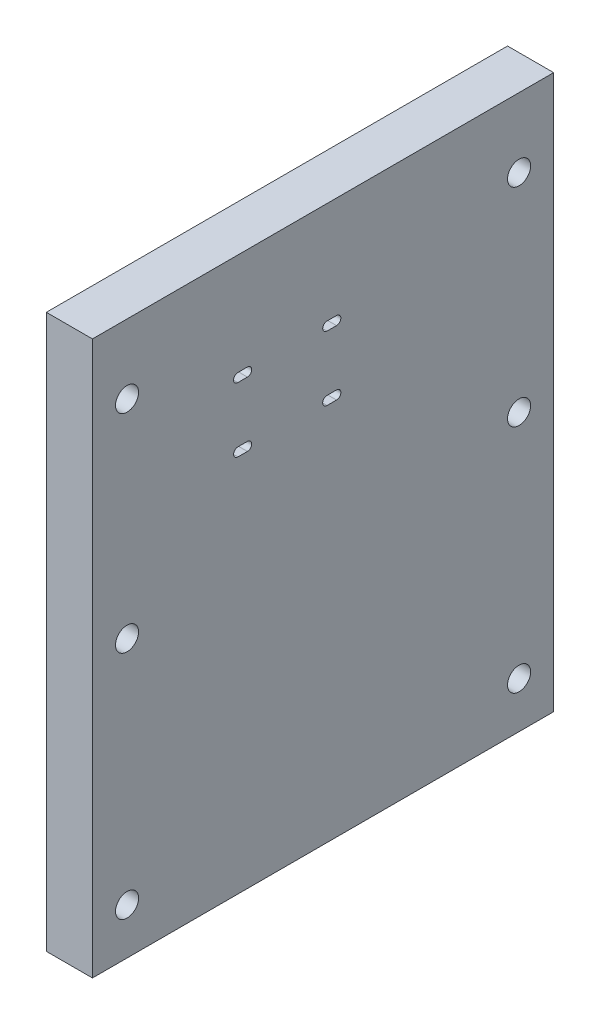
from build123d import *

# Parameters (mm, degrees)
SKETCH1_W           = 127
SKETCH1_H           = 152.4
SKETCH1_R           = 3.175
BOSS_EXTRUDE1_DEPTH = 12.7


with BuildPart() as part:
    # Sketch1 → Boss-Extrude1 (new body)
    with BuildSketch(Plane(origin=(0, 0, 0), x_dir=(0, 0, -1), z_dir=(1, 0, 0))):
        with Locations((38.1, 0)):
            Rectangle(SKETCH1_W, SKETCH1_H)
        with Locations((-15.875, 57.15)):
            Circle(SKETCH1_R, mode=Mode.SUBTRACT)
        with Locations((-15.875, 0)):
            Circle(SKETCH1_R, mode=Mode.SUBTRACT)
        with Locations((92.075, 57.15)):
            Circle(SKETCH1_R, mode=Mode.SUBTRACT)
        with Locations((92.075, 0)):
            Circle(SKETCH1_R, mode=Mode.SUBTRACT)
        with Locations((-15.875, -63.5)):
            Circle(SKETCH1_R, mode=Mode.SUBTRACT)
        with Locations((92.075, -63.5)):
            Circle(SKETCH1_R, mode=Mode.SUBTRACT)
        with BuildLine():
            ThreePointArc((17.261210647, 30.43), (18.461210647, 29.23), (17.261210647, 28.03))
            Line((17.261210647, 28.03), (14.661210647, 28.03))
            ThreePointArc((14.661210647, 28.03), (13.461210647, 29.23), (14.661210647, 30.43))
            Line((14.661210647, 30.43), (17.261210647, 30.43))
        make_face(mode=Mode.SUBTRACT)
        with BuildLine():
            Line((41.801210647, 28.03), (39.201210647, 28.03))
            ThreePointArc((39.201210647, 28.03), (38.001210647, 29.23), (39.201210647, 30.43))
            Line((39.201210647, 30.43), (41.801210647, 30.43))
            ThreePointArc((41.801210647, 30.43), (43.001210647, 29.23), (41.801210647, 28.03))
        make_face(mode=Mode.SUBTRACT)
        with BuildLine():
            ThreePointArc((39.201210647, 45.77), (38.001210647, 46.97), (39.201210647, 48.17))
            Line((39.201210647, 48.17), (41.801210647, 48.17))
            ThreePointArc((41.801210647, 48.17), (43.001210647, 46.97), (41.801210647, 45.77))
            Line((41.801210647, 45.77), (39.201210647, 45.77))
        make_face(mode=Mode.SUBTRACT)
        with BuildLine():
            Line((14.661210647, 48.17), (17.261210647, 48.17))
            ThreePointArc((17.261210647, 48.17), (18.461210647, 46.97), (17.261210647, 45.77))
            Line((17.261210647, 45.77), (14.661210647, 45.77))
            ThreePointArc((14.661210647, 45.77), (13.461210647, 46.97), (14.661210647, 48.17))
        make_face(mode=Mode.SUBTRACT)
    extrude(amount=BOSS_EXTRUDE1_DEPTH)


solid = part.part
